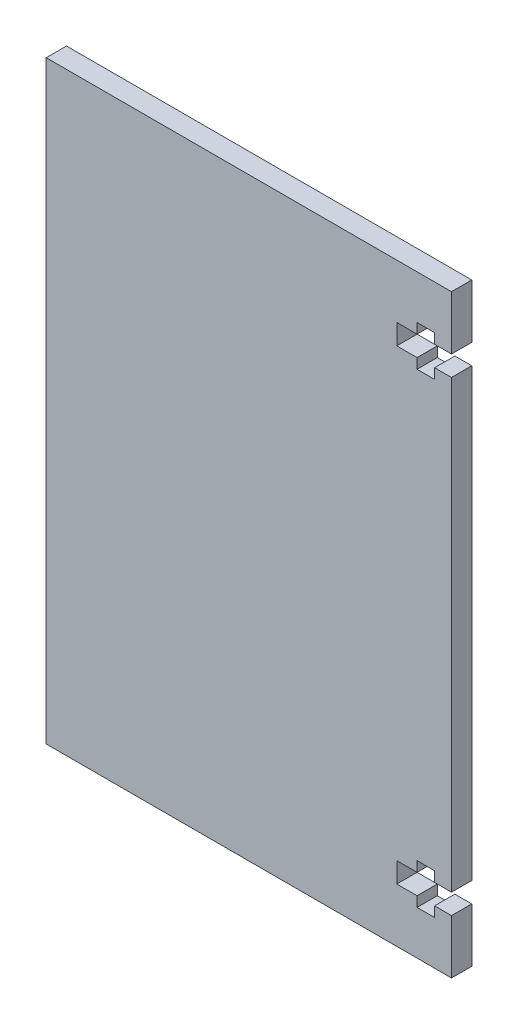
from build123d import *

# Parameters (mm, degrees)
EXTRUDE_1_DEPTH = 3


with BuildPart() as part:
    # 草图1 → 凸台-拉伸1 (new body)
    with BuildSketch(Plane.XY):
        Polygon((0, 44), (0, 36), (-2.5, 36), (-2.5, 37.5), (-5.1, 37.5), (-5.1, 36), (-8.1, 36), (-8.1, 33), (-5.1, 33), (-5.1, 31.5), (-2.5, 31.5), (-2.5, 33), (0, 33), (0, -33), (-2.5, -33), (-2.5, -31.5), (-5.1, -31.5), (-5.1, -33), (-8.1, -33), (-8.1, -36), (-5.1, -36), (-5.1, -37.5), (-2.5, -37.5), (-2.5, -36), (0, -36), (0, -44), (-60, -44), (-60, 44), align=None)
    extrude(amount=EXTRUDE_1_DEPTH)


solid = part.part
